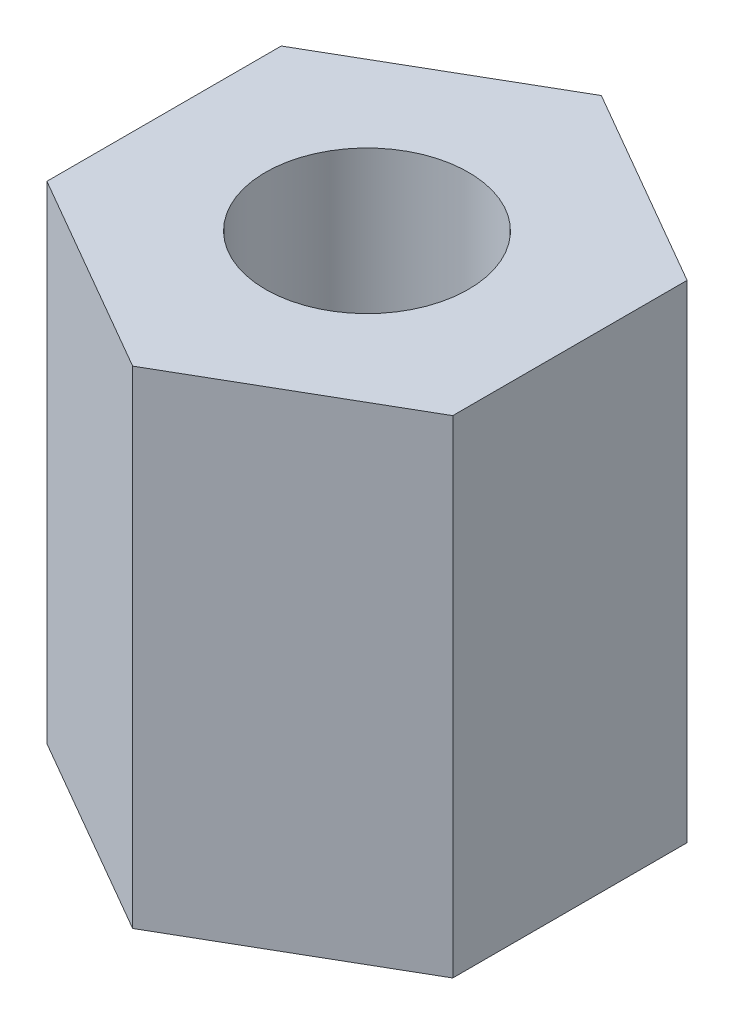
from build123d import *

# Parameters (mm, degrees)
SKETCH1_R           = 1.25
BOSS_EXTRUDE1_DEPTH = 6


with BuildPart() as part:
    # Sketch1 → Boss-Extrude1 (new body)
    with BuildSketch(Plane(origin=(0, 0, 0), x_dir=(1, 0, 0), z_dir=(0, 1, 0))):
        Polygon((0, 2.886751346), (-2.5, 1.443375673), (-2.5, -1.443375673), (0, -2.886751346), (2.5, -1.443375673), (2.5, 1.443375673), align=None)
        with Locations(Location((0, 0, 0), (0, 0, 270))):
            Circle(SKETCH1_R, mode=Mode.SUBTRACT)
    extrude(amount=BOSS_EXTRUDE1_DEPTH)


solid = part.part
